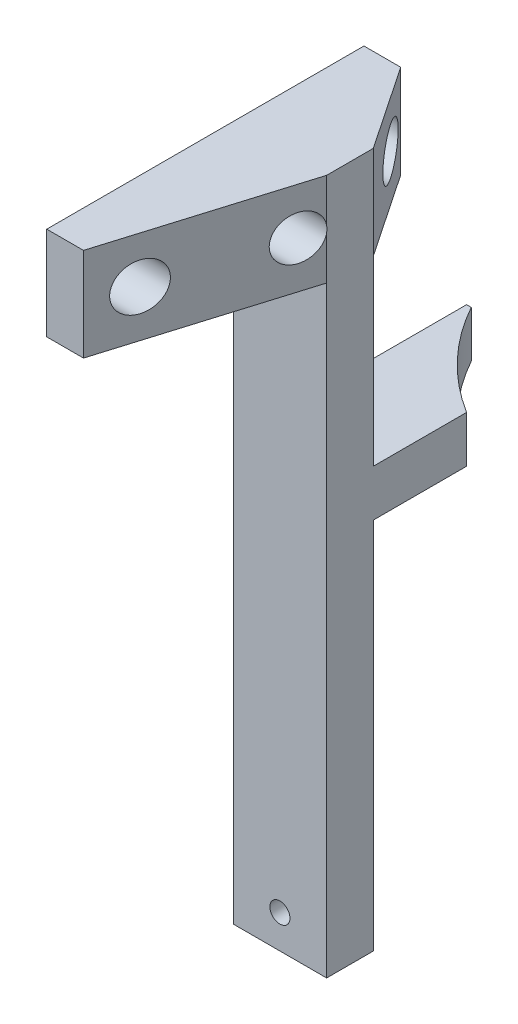
from build123d import *

# Parameters (mm, degrees)
SKETCH_1_W               = 20
SKETCH_1_H               = 149.015
SKETCH_1_R               = 2.15
EXTRUDE_1_DEPTH          = 10
SKETCH_2_W               = 20
SKETCH_2_H               = 20
EXTRUDE_2_DEPTH          = 40
SKETCH_3_W               = 20
SKETCH_3_H               = 20
EXTRUDE_3_DEPTH          = 18
CUT_EXTRUDE_1_DEPTH      = 10
CUT_EXTRUDE_1_DEPTH_BACK = 20
SKETCH_5_R               = 2.2
CUT_EXTRUDE_2_DEPTH      = 2
CUT_EXTRUDE_START        = -2
SKETCH_6_R               = 5
SKETCH_6_R_2             = 4.75
CUT_EXTRUDE_3_DEPTH      = 20
SKETCH_7_W               = 20
SKETCH_7_H               = 10
EXTRUDE_4_DEPTH          = 40
CUT_EXTRUDE_5_REACH      = 109.242


with BuildPart() as part:
    # 草图1 → 凸台-拉伸1 (new body)
    with BuildSketch(Plane.XY):
        with Locations((20.013762606, -57.295888527)):
            Rectangle(SKETCH_1_W, SKETCH_1_H)
        with Locations((20, -124.653388527)):
            Circle(SKETCH_1_R, mode=Mode.SUBTRACT)
    extrude(amount=EXTRUDE_1_DEPTH)

    # 草图2 → 凸台-拉伸2 (add)
    with BuildSketch(Plane.XY.offset(10)):
        with Locations((20.013762606, 7.211611473)):
            Rectangle(SKETCH_2_W, SKETCH_2_H)
    extrude(amount=EXTRUDE_2_DEPTH)

    # 草图3 → 凸台-拉伸3 (add)
    with BuildSketch(Plane(origin=(0, 0, 0), x_dir=(-1, 0, 0), z_dir=(0, 0, -1))):
        with Locations((-20.013762606, 7.211611473)):
            Rectangle(SKETCH_3_W, SKETCH_3_H)
    extrude(amount=EXTRUDE_3_DEPTH)

    # 草图4 → 切除-拉伸1 (cut, two sides: drawn at the far end of the back side and taken through both)
    with BuildSketch(Plane.XZ.offset(2.788388527).offset(-CUT_EXTRUDE_1_DEPTH_BACK)):
        Polygon((17.893762606, 50), (30.013762606, 50), (30.013762606, 10), align=None)
        Polygon((17.893762606, -18), (30.013762606, -18), (30.013762606, 0), align=None)
    extrude(amount=CUT_EXTRUDE_1_DEPTH + CUT_EXTRUDE_1_DEPTH_BACK, mode=Mode.SUBTRACT)

    # 草图5 → 切除-拉伸2 (cut)
    with BuildSketch(Plane.ZY.offset(-10.013762606)):
        with Locations(Location((14.7, 7.211611473, 0), (0, 0, 270))):
            Circle(SKETCH_5_R)
        with Locations(Location((40.7, 7.211611473, 0), (0, 0, 270))):
            Circle(SKETCH_5_R)
        with Locations(Location((-11.3, 7.211611473, 0), (0, 0, 270))):
            Circle(SKETCH_5_R)
    extrude(amount=-CUT_EXTRUDE_2_DEPTH, mode=Mode.SUBTRACT)

    # 草图6 → 切除-拉伸3 (cut)
    with BuildSketch(Plane.ZY.offset(-10.013762606).offset(CUT_EXTRUDE_START)):
        with Locations(Location((40.7, 7.211611473, 0), (0, 0, 270))):
            Circle(SKETCH_6_R)
        with Locations(Location((-11.3, 7.211611473, 0), (0, 0, 270))):
            Circle(SKETCH_6_R)
        with Locations(Location((14.7, 7.211611473, 0), (0, 0, 270))):
            Circle(SKETCH_6_R_2)
    extrude(amount=-CUT_EXTRUDE_3_DEPTH, mode=Mode.SUBTRACT)

    # 草图7 → 凸台-拉伸4 (add)
    with BuildSketch(Plane(origin=(0, 0, 0), x_dir=(-1, 0, 0), z_dir=(0, 0, -1))):
        with Locations((-20.013762606, -46.803388527)):
            Rectangle(SKETCH_7_W, SKETCH_7_H)
    extrude(amount=EXTRUDE_4_DEPTH)

    # 草图8 → 切除-拉伸5 (cut, up to next)
    with BuildSketch(Plane(origin=(0, -41.803388527, 0), x_dir=(1, 0, 0), z_dir=(0, 1, 0)), mode=Mode.PRIVATE) as cut_extrude_5_sk1:
        with BuildLine():
            Line((30.013762606, 20), (30.013762606, 40))
            Line((30.013762606, 40), (11.013762606, 40))
            ThreePointArc((11.013762606, 40), (19.239482102, 28.789433521), (30.013762606, 20))
        make_face()
    cut_extrude_5_tool1 = extrude(cut_extrude_5_sk1.sketch, amount=-CUT_EXTRUDE_5_REACH, mode=Mode.PRIVATE) & part.part
    add(cut_extrude_5_tool1.solids().sort_by_distance((23.14433, -41.803389, -32.776655))[0], mode=Mode.SUBTRACT)


solid = part.part
